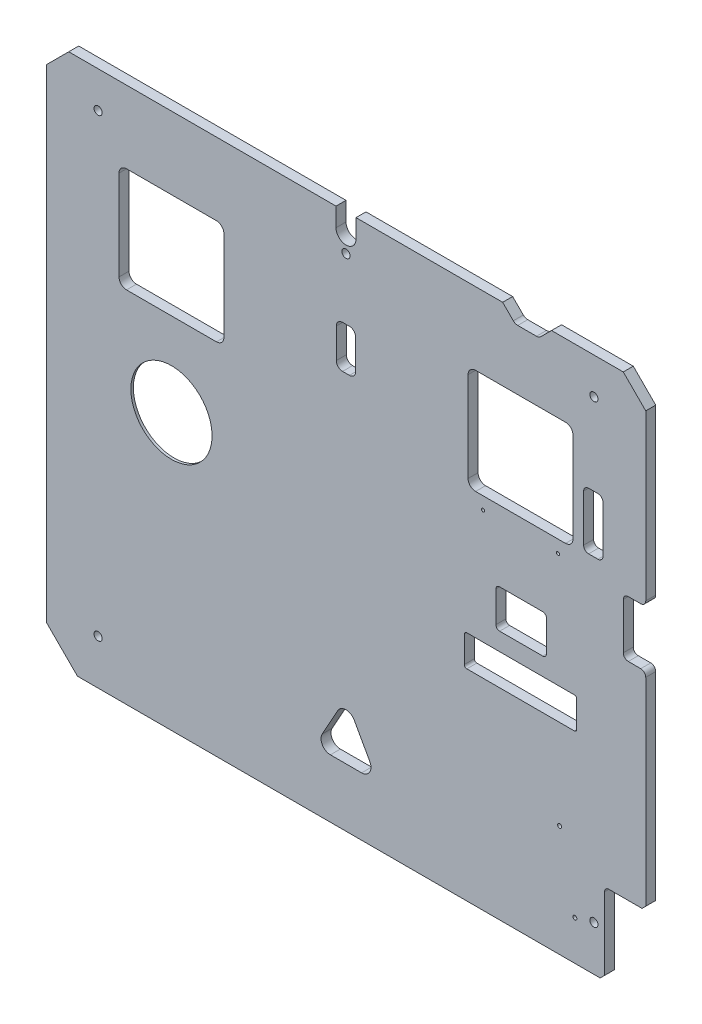
from build123d import *

# Parameters (mm, degrees)
BOSS_EXTRUDE1_DEPTH        = 8
F_6_5_6_5_DIAMETER_HOLE1_D = 6.5
CUT_EXTRUDE1_DEPTH         = 325.495088493
CUT_EXTRUDE6_REACH         = 326.495
CUT_EXTRUDE7_REACH         = 326.495
CUT_EXTRUDE5_REACH         = 326.495
SKETCH9_R                  = 32.5
CHAMFER1_SIZE              = 9
CHAMFER1_SIZE2             = 6
CUT_EXTRUDE8_REACH         = 326.495
SKETCH13_R                 = 1.6
CUT_EXTRUDE9_REACH         = 326.495
CUT_EXTRUDE10_DEPTH        = 325.495088493
CUT_EXTRUDE11_REACH        = 326.495
SKETCH16_R                 = 1.25


with BuildPart() as part:
    # Sketch1 → Boss-Extrude1 (new body)
    with BuildSketch(Plane.XY.offset(8)):
        with BuildLine():
            Line((152.5, 201.25), (137.5, 201.25))
            ThreePointArc((137.5, 201.25), (135.586582838, 201.630602337), (133.964466094, 202.714466094))
            Line((133.964466094, 202.714466094), (125.428932188, 211.25))
            Line((125.428932188, 211.25), (-222, 211.25))
            Line((-222, 211.25), (-240, 193.25))
            Line((-240, 193.25), (-240, -193.249999907))
            Line((-240, -193.249999907), (-215.000000007, -218.249999899))
            Line((-215.000000007, -218.249999899), (203.5, -218.249999899))
            Line((203.5, -218.249999899), (208.5, -213.249999899))
            Line((208.5, -213.249999899), (208.5, -157.249999899))
            ThreePointArc((208.5, -157.249999899), (209.085786438, -155.835786337), (210.5, -155.249999899))
            Line((210.5, -155.249999899), (235, -155.249999899))
            Line((235, -155.249999899), (240, -150.249999899))
            Line((240, -150.249999899), (240, 8.5))
            ThreePointArc((240, 8.5), (238.828427125, 11.328427125), (236, 12.5))
            Line((236, 12.5), (226, 12.5))
            ThreePointArc((226, 12.5), (223.171572875, 13.671572875), (222, 16.5))
            Line((222, 16.5), (222, 53.5))
            ThreePointArc((222, 53.5), (223.171572875, 56.328427125), (226, 57.5))
            Line((226, 57.5), (236, 57.5))
            ThreePointArc((236, 57.5), (238.828427125, 58.671572875), (240, 61.5))
            Line((240, 61.5), (240, 193.25))
            Line((240, 193.25), (222, 211.25))
            Line((222, 211.25), (164.571067812, 211.25))
            Line((164.571067812, 211.25), (156.035533906, 202.714466094))
            ThreePointArc((156.035533906, 202.714466094), (154.413417162, 201.630602337), (152.5, 201.25))
        make_face()
    extrude(amount=-BOSS_EXTRUDE1_DEPTH)

    # Ø6.5 (6.5) Diameter Hole1 (through all)
    with Locations(Plane.XY.offset(8)):
        with Locations((198.5, -182.25), (0, 182.25), (-198.5, -182.25), (198.5, 182.25), (-198.5, 182.25)):
            Hole(F_6_5_6_5_DIAMETER_HOLE1_D / 2)

    # Sketch4 → Cut-Extrude1 (cut, through all)
    with BuildSketch(Plane(origin=(0, 0, 0), x_dir=(-1, 0, 0), z_dir=(0, 0, -1))):
        with BuildLine():
            Line((-6.556179571, -137.857678016), (-19.056179571, -160.357678016))
            ThreePointArc((-19.056179571, -160.357678016), (-18.964031825, -167.803457974), (-12.5, -171.5))
            Line((-12.5, -171.5), (12.5, -171.5))
            ThreePointArc((12.5, -171.5), (18.964031825, -167.803457974), (19.056179571, -160.357678016))
            Line((19.056179571, -160.357678016), (6.556179571, -137.857678016))
            ThreePointArc((6.556179571, -137.857678016), (0, -134), (-6.556179571, -137.857678016))
        make_face()
    extrude(amount=-CUT_EXTRUDE1_DEPTH, mode=Mode.SUBTRACT)

    # Sketch12 → Cut-Extrude6 (cut, up to next)
    with BuildSketch(Plane(origin=(0, 0, 0), x_dir=(-1, 0, 0), z_dir=(0, 0, -1)), mode=Mode.PRIVATE) as cut_extrude6_sk1:
        with BuildLine():
            Line((103.75, 153.25), (175.75, 153.25))
            ThreePointArc((175.75, 153.25), (179.992640687, 151.492640687), (181.75, 147.25))
            Line((181.75, 147.25), (181.75, 75.25))
            ThreePointArc((181.75, 75.25), (179.992640687, 71.007359313), (175.75, 69.25))
            Line((175.75, 69.25), (103.75, 69.25))
            ThreePointArc((103.75, 69.25), (99.507359313, 71.007359313), (97.75, 75.25))
            Line((97.75, 75.25), (97.75, 147.25))
            ThreePointArc((97.75, 147.25), (99.507359313, 151.492640687), (103.75, 153.25))
        make_face()
    cut_extrude6_tool1 = extrude(cut_extrude6_sk1.sketch, amount=-CUT_EXTRUDE6_REACH, mode=Mode.PRIVATE) & part.part
    # Sketch12 → Cut-Extrude6 (cut, up to next)
    with BuildSketch(Plane(origin=(0, 0, 0), x_dir=(-1, 0, 0), z_dir=(0, 0, -1)), mode=Mode.PRIVATE) as cut_extrude6_sk2:
        with BuildLine():
            Line((123, 12.75), (157.5, 12.75))
            ThreePointArc((157.5, 12.75), (159.621320344, 11.871320344), (160.5, 9.75))
            Line((160.5, 9.75), (160.5, -15))
            ThreePointArc((160.5, -15), (159.621320344, -17.121320344), (157.5, -18))
            Line((157.5, -18), (123, -18))
            ThreePointArc((123, -18), (120.878679656, -17.121320344), (120, -15))
            Line((120, -15), (120, 9.75))
            ThreePointArc((120, 9.75), (120.878679656, 11.871320344), (123, 12.75))
        make_face()
    cut_extrude6_tool2 = extrude(cut_extrude6_sk2.sketch, amount=-CUT_EXTRUDE6_REACH, mode=Mode.PRIVATE) & part.part
    cut_extrude6_1 = cut_extrude6_tool1.solids().sort_by_distance((-139.75, 111.25, 0))[0]
    add(cut_extrude6_1, mode=Mode.SUBTRACT)
    cut_extrude6_2 = cut_extrude6_tool2.solids().sort_by_distance((-140.25, -2.625, 0))[0]
    add(cut_extrude6_2, mode=Mode.SUBTRACT)
    cut_extrude6 = cut_extrude6_1 + cut_extrude6_2  # Cut-Extrude6 as one shape, for the pattern or mirror that repeats it

    # Mirror1: Cut-Extrude6 across plane
    add(cut_extrude6.mirror(Plane(origin=(0, 0, 0), x_dir=(0, 0, 1), z_dir=(1, 0, 0))), mode=Mode.SUBTRACT)

    # Sketch11 → Cut-Extrude7 (cut, up to next)
    with BuildSketch(Plane(origin=(0, 0, 0), x_dir=(-1, 0, 0), z_dir=(0, 0, -1)), mode=Mode.PRIVATE) as cut_extrude7_sk1:
        with BuildLine():
            Line((-2.75, 133.25), (2.75, 133.25))
            ThreePointArc((2.75, 133.25), (6.285533906, 131.785533906), (7.75, 128.25))
            Line((7.75, 128.25), (7.75, 104.25))
            ThreePointArc((7.75, 104.25), (6.285533906, 100.714466094), (2.75, 99.25))
            Line((2.75, 99.25), (-2.75, 99.25))
            ThreePointArc((-2.75, 99.25), (-6.285533906, 100.714466094), (-7.75, 104.25))
            Line((-7.75, 104.25), (-7.75, 128.25))
            ThreePointArc((-7.75, 128.25), (-6.285533906, 131.785533906), (-2.75, 133.25))
        make_face()
    cut_extrude7_tool1 = extrude(cut_extrude7_sk1.sketch, amount=-CUT_EXTRUDE7_REACH, mode=Mode.PRIVATE) & part.part
    # Sketch11 → Cut-Extrude7 (cut, up to next)
    with BuildSketch(Plane(origin=(0, 0, 0), x_dir=(-1, 0, 0), z_dir=(0, 0, -1)), mode=Mode.PRIVATE) as cut_extrude7_sk2:
        with BuildLine():
            Line((-201.75, 116.75), (-194.25, 116.75))
            ThreePointArc((-194.25, 116.75), (-191.421572875, 115.578427125), (-190.25, 112.75))
            Line((-190.25, 112.75), (-190.25, 75.25))
            ThreePointArc((-190.25, 75.25), (-191.421572875, 72.421572875), (-194.25, 71.25))
            Line((-194.25, 71.25), (-201.75, 71.25))
            ThreePointArc((-201.75, 71.25), (-204.578427125, 72.421572875), (-205.75, 75.25))
            Line((-205.75, 75.25), (-205.75, 112.75))
            ThreePointArc((-205.75, 112.75), (-204.578427125, 115.578427125), (-201.75, 116.75))
        make_face()
    cut_extrude7_tool2 = extrude(cut_extrude7_sk2.sketch, amount=-CUT_EXTRUDE7_REACH, mode=Mode.PRIVATE) & part.part
    add(cut_extrude7_tool1.solids().sort_by_distance((0, 116.25, 0))[0], mode=Mode.SUBTRACT)
    add(cut_extrude7_tool2.solids().sort_by_distance((198, 94, 0))[0], mode=Mode.SUBTRACT)

    # Sketch9 → Cut-Extrude5 (cut, up to next)
    with BuildSketch(Plane(origin=(0, 0, 0), x_dir=(-1, 0, 0), z_dir=(0, 0, -1)), mode=Mode.PRIVATE) as cut_extrude5_sk1:
        with Locations((139.75, 2.25)):
            Circle(SKETCH9_R)
    cut_extrude5_tool1 = extrude(cut_extrude5_sk1.sketch, amount=-CUT_EXTRUDE5_REACH, mode=Mode.PRIVATE) & part.part
    add(cut_extrude5_tool1.solids().sort_by_distance((-139.75, 2.25, 0))[0], mode=Mode.SUBTRACT)

    # Chamfer1
    chamfer1_edges = [part.edges().sort_by_distance(p)[0] for p in [
        (-107.25, 2.25, 0),
    ]]
    chamfer1_side = [part.faces().sort_by_distance(p)[0] for p in [
        (-2.503127198, -10.867495519, 0),
    ]]
    chamfer(chamfer1_edges, length=CHAMFER1_SIZE, length2=CHAMFER1_SIZE2, reference=chamfer1_side[0])

    # Sketch13 → Cut-Extrude8 (cut, up to next)
    with BuildSketch(Plane.XY.offset(8), mode=Mode.PRIVATE) as cut_extrude8_sk1:
        with Locations((171, -129)):
            Circle(SKETCH13_R)
    cut_extrude8_tool1 = extrude(cut_extrude8_sk1.sketch, amount=-CUT_EXTRUDE8_REACH, mode=Mode.PRIVATE) & part.part
    # Sketch13 → Cut-Extrude8 (cut, up to next)
    with BuildSketch(Plane.XY.offset(8), mode=Mode.PRIVATE) as cut_extrude8_sk2:
        with Locations((183.25, -186.6)):
            Circle(SKETCH13_R)
    cut_extrude8_tool2 = extrude(cut_extrude8_sk2.sketch, amount=-CUT_EXTRUDE8_REACH, mode=Mode.PRIVATE) & part.part
    add(cut_extrude8_tool1.solids().sort_by_distance((171, -129, 8))[0], mode=Mode.SUBTRACT)
    add(cut_extrude8_tool2.solids().sort_by_distance((183.25, -186.6, 8))[0], mode=Mode.SUBTRACT)

    # Sketch14 → Cut-Extrude9 (cut, up to next)
    with BuildSketch(Plane.XY.offset(8), mode=Mode.PRIVATE) as cut_extrude9_sk1:
        with BuildLine():
            Line((8, 245.685058497), (8, 196.25))
            ThreePointArc((8, 196.25), (0, 188.25), (-8, 196.25))
            Line((-8, 196.25), (-8, 245.685058497))
            ThreePointArc((-8, 245.685058497), (0, 253.685058497), (8, 245.685058497))
        make_face()
    cut_extrude9_tool1 = extrude(cut_extrude9_sk1.sketch, amount=-CUT_EXTRUDE9_REACH, mode=Mode.PRIVATE) & part.part
    add(cut_extrude9_tool1.solids().sort_by_distance((0, 220.967529, 8))[0], mode=Mode.SUBTRACT)

    # Sketch15 → Cut-Extrude10 (cut, through all)
    with BuildSketch(Plane(origin=(0, 0, 0), x_dir=(-1, 0, 0), z_dir=(0, 0, -1))):
        with BuildLine():
            Line((-240, -153.249999899), (-240, -218.249999899))
            Line((-240, -218.249999899), (-207, -218.249999899))
            Line((-207, -218.249999899), (-207, -156.749999899))
            ThreePointArc((-207, -156.749999899), (-208.025126266, -154.275126165), (-210.5, -153.249999899))
            Line((-210.5, -153.249999899), (-240, -153.249999899))
        make_face()
    extrude(amount=-CUT_EXTRUDE10_DEPTH, mode=Mode.SUBTRACT)

    # Sketch16 → Cut-Extrude11 (cut, up to next)
    with BuildSketch(Plane(origin=(0, 0, 0), x_dir=(-1, 0, 0), z_dir=(0, 0, -1)), mode=Mode.PRIVATE) as cut_extrude11_sk1:
        with Locations((-169.75, 59.25)):
            Circle(SKETCH16_R)
    cut_extrude11_tool1 = extrude(cut_extrude11_sk1.sketch, amount=-CUT_EXTRUDE11_REACH, mode=Mode.PRIVATE) & part.part
    # Sketch16 → Cut-Extrude11 (cut, up to next)
    with BuildSketch(Plane(origin=(0, 0, 0), x_dir=(-1, 0, 0), z_dir=(0, 0, -1)), mode=Mode.PRIVATE) as cut_extrude11_sk2:
        with Locations((-109.75, 59.25)):
            Circle(SKETCH16_R)
    cut_extrude11_tool2 = extrude(cut_extrude11_sk2.sketch, amount=-CUT_EXTRUDE11_REACH, mode=Mode.PRIVATE) & part.part
    # Sketch16 → Cut-Extrude11 (cut, up to next)
    with BuildSketch(Plane(origin=(0, 0, 0), x_dir=(-1, 0, 0), z_dir=(0, 0, -1)), mode=Mode.PRIVATE) as cut_extrude11_sk3:
        with BuildLine():
            Line((-182.75, -32.25), (-96.75, -32.25))
            ThreePointArc((-96.75, -32.25), (-95.335786438, -32.835786438), (-94.75, -34.25))
            Line((-94.75, -34.25), (-94.75, -55.25))
            ThreePointArc((-94.75, -55.25), (-95.335786438, -56.664213562), (-96.75, -57.25))
            Line((-96.75, -57.25), (-182.75, -57.25))
            ThreePointArc((-182.75, -57.25), (-184.164213562, -56.664213562), (-184.75, -55.25))
            Line((-184.75, -55.25), (-184.75, -34.25))
            ThreePointArc((-184.75, -34.25), (-184.164213562, -32.835786438), (-182.75, -32.25))
        make_face()
    cut_extrude11_tool3 = extrude(cut_extrude11_sk3.sketch, amount=-CUT_EXTRUDE11_REACH, mode=Mode.PRIVATE) & part.part
    add(cut_extrude11_tool1.solids().sort_by_distance((169.75, 59.25, 0))[0], mode=Mode.SUBTRACT)
    add(cut_extrude11_tool2.solids().sort_by_distance((109.75, 59.25, 0))[0], mode=Mode.SUBTRACT)
    add(cut_extrude11_tool3.solids().sort_by_distance((139.75, -44.75, 0))[0], mode=Mode.SUBTRACT)


solid = part.part
